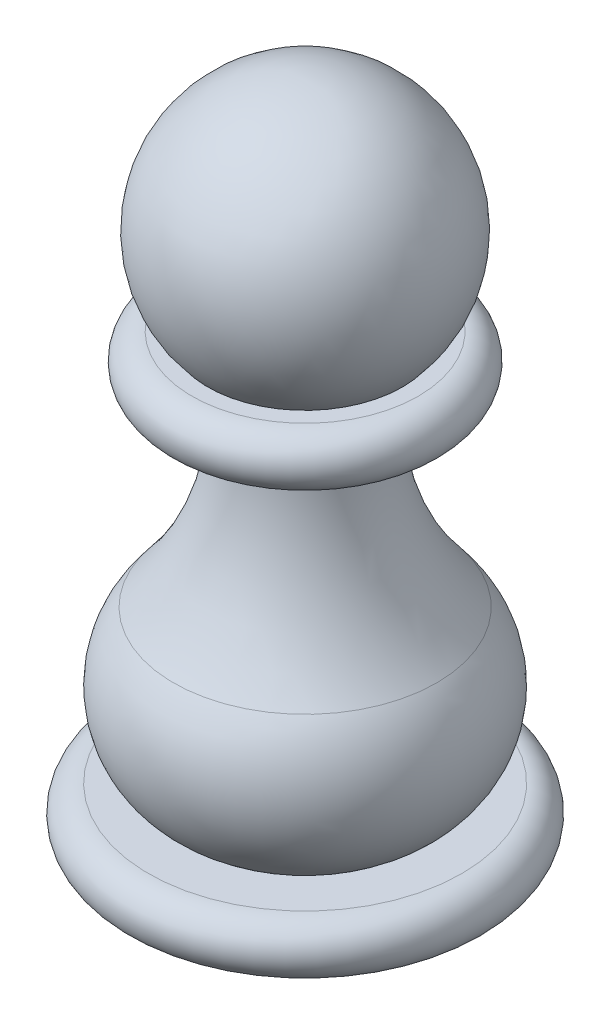
from build123d import *


with BuildPart() as part:
    # Sketch1 → Revolve5 (revolve)
    with BuildSketch(Plane.XY):
        with BuildLine():
            Line((4, -15.5), (6.5, -15.5))
            ThreePointArc((6.5, -15.5), (8, -14), (6.5, -12.5))
            Line((6.5, -12.5), (5.590169944, -12.5))
            ThreePointArc((5.590169944, -12.5), (6.846531969, -4.438137822), (0, 0))
            Line((0, 0), (0, -38))
            Line((0, -38), (9, -38))
            ThreePointArc((9, -38), (10.5, -36.5), (9, -35))
            Line((9, -35), (6.5, -35))
            ThreePointArc((6.5, -35), (8.956479045, -30.847960847), (7.562140976, -26.229569377))
            ThreePointArc((7.562140976, -26.229569377), (4.731529648, -21.213224807), (4, -15.5))
        make_face()
    revolve(axis=Axis((0, 0, 0), (0, 1, 0)))


solid = part.part
